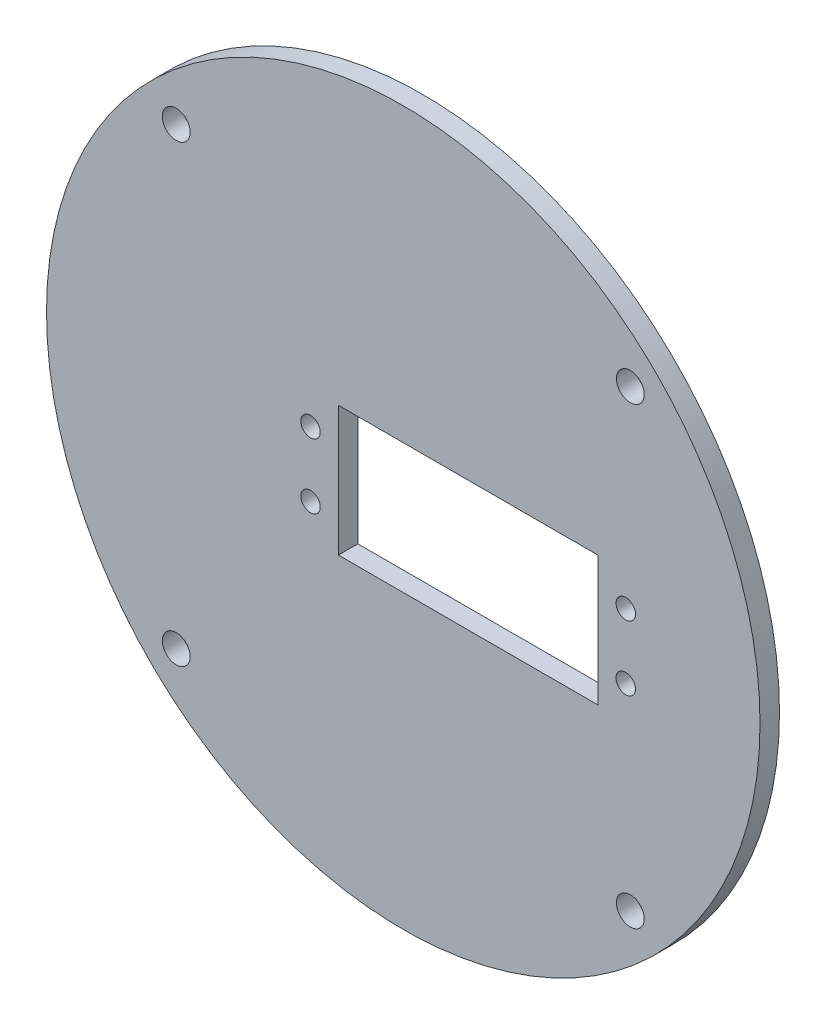
from build123d import *

# Parameters (mm, degrees)
SKETCH_1_R      = 55
SKETCH_1_R_2    = 2.15
SKETCH_1_R_3    = 1.5
SKETCH_1_W      = 40
SKETCH_1_H      = 20
EXTRUDE_2_DEPTH = 3


with BuildPart() as part:
    # 草图1 → 凸台-拉伸2 (new body)
    with BuildSketch(Plane.XY):
        Circle(SKETCH_1_R)
        with Locations((-35.001785669, 35.001785669)):
            Circle(SKETCH_1_R_2, mode=Mode.SUBTRACT)
        with Locations((35.001785669, 35.001785669)):
            Circle(SKETCH_1_R_2, mode=Mode.SUBTRACT)
        with Locations((35.001785669, -35.001785669)):
            Circle(SKETCH_1_R_2, mode=Mode.SUBTRACT)
        with Locations((-35.001785669, -35.001785669)):
            Circle(SKETCH_1_R_2, mode=Mode.SUBTRACT)
        with Locations((-14.3, 5)):
            Circle(SKETCH_1_R_3, mode=Mode.SUBTRACT)
        with Locations((-14.3, -5)):
            Circle(SKETCH_1_R_3, mode=Mode.SUBTRACT)
        with Locations((34.3, 5)):
            Circle(SKETCH_1_R_3, mode=Mode.SUBTRACT)
        with Locations((34.3, -5)):
            Circle(SKETCH_1_R_3, mode=Mode.SUBTRACT)
        with Locations((10, 0)):
            Rectangle(SKETCH_1_W, SKETCH_1_H, mode=Mode.SUBTRACT)
    extrude(amount=EXTRUDE_2_DEPTH)


solid = part.part
